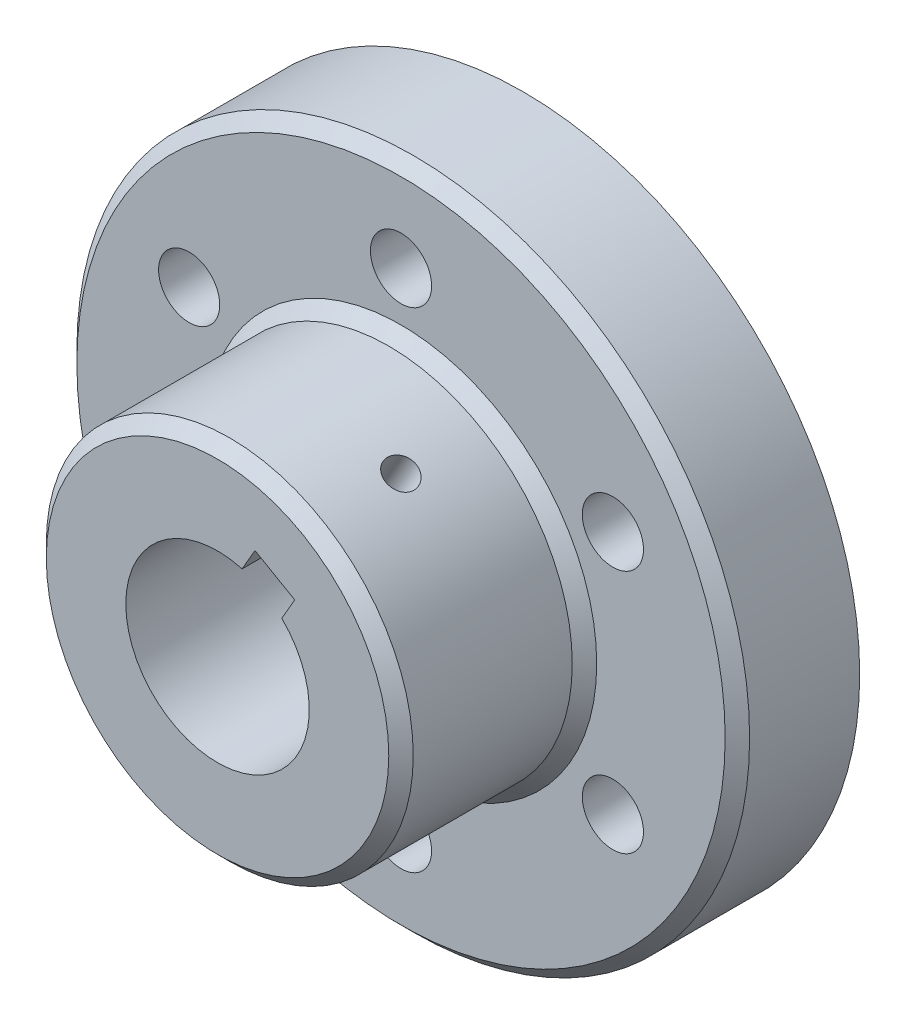
from build123d import *

# Parameters (mm, degrees)
SKETCH1_R          = 34.925
EXTRUDE1_DEPTH     = 12.7
SKETCH2_R          = 19.05
EXTRUDE2_DEPTH     = 19.05
SKETCH3_R          = 3.175
SKETCH3_R_2        = 9.525
CUT_EXTRUDE1_DEPTH = 59.716043378
CIRPATTERN1_COUNT  = 6
CUT_EXTRUDE2_DEPTH = 59.716043378
SKETCH5_R          = 1.5875
CUT_EXTRUDE3_DEPTH = 69.74147002
CHAMFER1_SIZE      = 1.27


with BuildPart() as part:
    # Sketch1 → Extrude1 (new body)
    with BuildSketch(Plane.XY):
        Circle(SKETCH1_R)
    extrude(amount=EXTRUDE1_DEPTH)

    # Sketch2 → Extrude2 (add)
    with BuildSketch(Plane.XY.offset(12.7)):
        with Locations(Location((0, 0, 0), (0, 0, 180))):
            Circle(SKETCH2_R)
    extrude(amount=EXTRUDE2_DEPTH)

    # Sketch3 → Cut-Extrude1 (cut, through all)
    with BuildSketch(Plane(origin=(0, 0, 0), x_dir=(-1, 0, 0), z_dir=(0, 0, -1))):
        with Locations((0, 25.4)):
            Circle(SKETCH3_R)
        Circle(SKETCH3_R_2)
    cut_extrude1 = extrude(amount=-CUT_EXTRUDE1_DEPTH, mode=Mode.SUBTRACT)

    # CirPattern1: Cut-Extrude1 ×6 about axis
    cirpattern1_axis = Axis((0, 0, 0), (0, 0, 1))
    for i in range(1, CIRPATTERN1_COUNT):
        add(cut_extrude1.rotate(cirpattern1_axis, i * 360 / CIRPATTERN1_COUNT), mode=Mode.SUBTRACT)

    # Sketch4 → Cut-Extrude2 (cut, through all)
    with BuildSketch(Plane(origin=(0, 0, 0), x_dir=(-1, 0, 0), z_dir=(0, 0, -1))):
        Polygon((-1.509652007, 7.377293978), (-5.634097993, 4.996043978), (-8.015347993, 9.120489964), (-3.890902007, 11.501739964), align=None)
    extrude(amount=-CUT_EXTRUDE2_DEPTH, mode=Mode.SUBTRACT)

    # Sketch5 → Cut-Extrude3 (cut, through all)
    with BuildSketch(Plane(origin=(5.953125, 10.311114964, 0), x_dir=(0.8660254037844396, -0.4999999999999984, 0), z_dir=(-0.4999999999999984, -0.8660254037844396, 0))):
        with Locations((0, 22.225)):
            Circle(SKETCH5_R)
    extrude(amount=-CUT_EXTRUDE3_DEPTH, mode=Mode.SUBTRACT)

    # Chamfer1
    chamfer1_edges = [part.edges().sort_by_distance(p)[0] for p in [
        (-34.925, 0, 12.7),
        (19.05, 0, 12.7),
        (19.05, 0, 31.75),
    ]]
    chamfer(chamfer1_edges, length=CHAMFER1_SIZE)


solid = part.part
